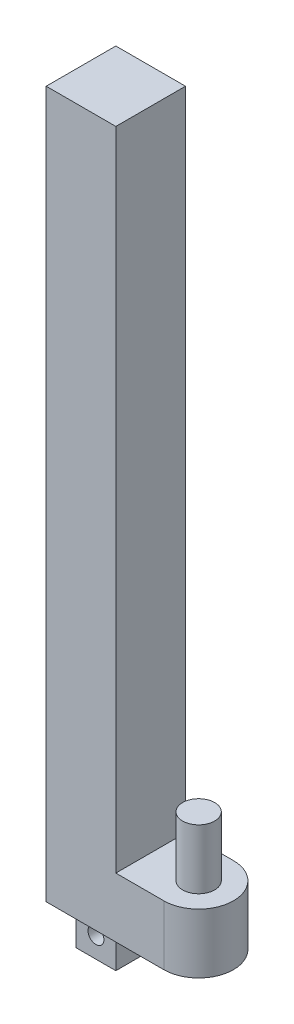
from build123d import *

# Parameters (mm, degrees)
SKETCH1_W           = 35
SKETCH1_H           = 35
BOSS_EXTRUDE1_DEPTH = 355
SKETCH1_3_R         = 8.057610329
BOSS_EXTRUDE2_DEPTH = 30
SKETCH1_4_R         = 8.057610329
BOSS_EXTRUDE3_DEPTH = 60
SKETCH2_W           = 20
SKETCH2_H           = 20
BOSS_EXTRUDE4_DEPTH = 20
CUT_EXTRUDE1_REACH  = 362.939
SKETCH3_R           = 4


with BuildPart() as part:
    # Sketch1 → Boss-Extrude1 (new body)
    with BuildSketch(Plane(origin=(0, 0, 0), x_dir=(1, 0, 0), z_dir=(0, 1, 0))):
        Rectangle(SKETCH1_W, SKETCH1_H)
    extrude(amount=BOSS_EXTRUDE1_DEPTH)

    # Sketch1<3> → Boss-Extrude2 (add)
    with BuildSketch(Plane(origin=(0, 0, 0), x_dir=(1, 0, 0), z_dir=(0, 1, 0))):
        with BuildLine():
            Line((41.626297716, 17.5), (17.5, 17.5))
            Line((17.5, 17.5), (17.5, -17.5))
            Line((17.5, -17.5), (41.626297716, -17.5))
            ThreePointArc((41.626297716, -17.5), (59.126297716, 0), (41.626297716, 17.5))
        make_face()
        with Locations((41.626297716, 0)):
            Circle(SKETCH1_3_R, mode=Mode.SUBTRACT)
    extrude(amount=BOSS_EXTRUDE2_DEPTH)

    # Sketch1<4> → Boss-Extrude3 (add)
    with BuildSketch(Plane(origin=(0, 0, 0), x_dir=(1, 0, 0), z_dir=(0, 1, 0))):
        with Locations((41.626297716, 0)):
            Circle(SKETCH1_4_R)
    extrude(amount=BOSS_EXTRUDE3_DEPTH)

    # Sketch2 → Boss-Extrude4 (add)
    with BuildSketch(Plane.XZ):
        Rectangle(SKETCH2_W, SKETCH2_H)
    extrude(amount=BOSS_EXTRUDE4_DEPTH)

    # Sketch3 → Cut-Extrude1 (cut, up to next)
    with BuildSketch(Plane.XY.offset(10), mode=Mode.PRIVATE) as cut_extrude1_sk1:
        with Locations((0, -9.583237288)):
            Circle(SKETCH3_R)
    cut_extrude1_tool1 = extrude(cut_extrude1_sk1.sketch, amount=-CUT_EXTRUDE1_REACH, mode=Mode.PRIVATE) & part.part
    add(cut_extrude1_tool1.solids().sort_by_distance((0, -9.583237, 10))[0], mode=Mode.SUBTRACT)


solid = part.part
